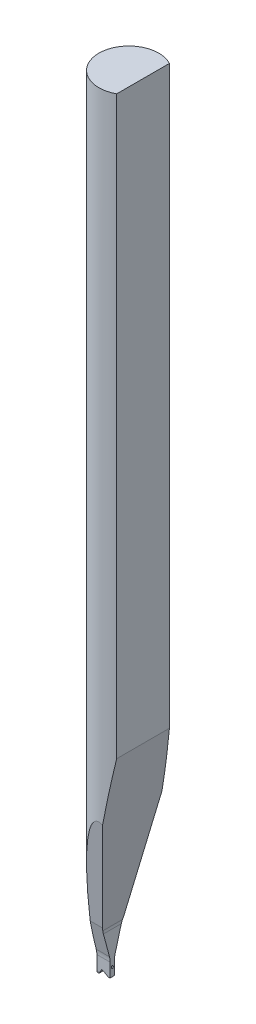
from build123d import *

# Parameters (mm, degrees)
TD_REV_FEATURE_DEPTH            = 21.0312
ISA_REV_FEATURE_DEPTH           = 22.061040395
ISA_REV_FEATURE_DEPTH_BACK      = 22.061040395
BA_REV_FEATURE_DEPTH            = 22.061040395
BA_REV_FEATURE_DEPTH_BACK       = 22.061040395
SLB_REV_FEATURE_DEPTH           = 22.061040395
SLB_REV_FEATURE_DEPTH_BACK      = 22.061040395
VR_REV_FEATURE_DEPTH            = 22.061040395
VR_REV_FEATURE_DEPTH_BACK       = 22.061040395
ND_REV_FEATURE_DEPTH            = 22.061040503
ND_REV_FEATURE_DEPTH_BACK       = 22.061040503
REV_HOLE_CUT_FEATURE_DEPTH      = 22.162851782
REV_HOLE_CUT_FEATURE_DEPTH_BACK = 22.162851782
REV_F_FR_FEATURE_R              = 0.0254
REV_F_BR_FEAUTRE_R              = 0.0254


with BuildPart() as part:
    # td_rev_sketch → td_rev_feature (new body)
    with BuildSketch(Plane(origin=(0, 0, 0), x_dir=(1, 0, 0), z_dir=(0, 1, 0))):
        with BuildLine():
            Line((0.37592, -0.697645113), (0.37592, 0.697645113))
            ThreePointArc((0.37592, 0.697645113), (-0.79248, 0), (0.37592, -0.697645113))
        make_face()
    extrude(amount=TD_REV_FEATURE_DEPTH)

    # isa_rev_sketch → isa_rev_feature (cut, two sides: drawn at the far end of the back side and taken through both)
    with BuildSketch(Plane(origin=(0, 0, 0), x_dir=(0, 0, -1), z_dir=(1, 0, 0)).offset(-ISA_REV_FEATURE_DEPTH_BACK)):
        Polygon((8.398066277, 47.339699483), (0.79248, 4.2062763), (0.0508, 0), (-0.0508, 0), (-0.79248, 4.2062763), (-8.398066277, 47.339699483), (-8.398066277, -40.25795204), (8.398066277, -40.25795204), align=None)
    extrude(amount=ISA_REV_FEATURE_DEPTH + ISA_REV_FEATURE_DEPTH_BACK, mode=Mode.SUBTRACT)

    # ba_rev_sketch → ba_rev_feature (cut, two sides: drawn at the far end of the back side and taken through both)
    with BuildSketch(Plane.XY.offset(-BA_REV_FEATURE_DEPTH_BACK)):
        Polygon((-52.01559187, -9.04993148), (-0.69088, 0), (-0.428729423, 0.04622422), (0.37592, 4.609617863), (9.42585148, 55.934329733), (85.165346017, -15.675992153), (23.723902667, -80.660253365), align=None)
    extrude(amount=BA_REV_FEATURE_DEPTH + BA_REV_FEATURE_DEPTH_BACK, mode=Mode.SUBTRACT)

    # slb_rev_sketch → slb_rev_feature (cut, two sides: drawn at the far end of the back side and taken through both)
    with BuildSketch(Plane.XY.offset(-SLB_REV_FEATURE_DEPTH_BACK)):
        with BuildLine():
            Line((-0.43688, -52.09380084), (-0.43688, 0))
            Line((-0.43688, 0), (-0.43688, 1.143))
            ThreePointArc((-0.43688, 1.143), (-0.434946907, 1.187275117), (-0.429162339, 1.231213274))
            Line((-0.429162339, 1.231213274), (0.37592, 5.797062104))
            Line((0.37592, 5.797062104), (9.421913584, 57.099441055))
            Line((9.421913584, 57.099441055), (113.187433376, 47.730703366))
            Line((113.187433376, 47.730703366), (103.328639792, -61.462538529))
            Line((103.328639792, -61.462538529), (-0.43688, -52.09380084))
        make_face()
    extrude(amount=SLB_REV_FEATURE_DEPTH + SLB_REV_FEATURE_DEPTH_BACK, mode=Mode.SUBTRACT)

    # vr_rev_sketch → vr_rev_feature (cut, two sides: drawn at the far end of the back side and taken through both)
    with BuildSketch(Plane(origin=(0, 0, 0), x_dir=(0, 0, -1), z_dir=(1, 0, 0)).offset(-VR_REV_FEATURE_DEPTH_BACK)):
        with BuildLine():
            Line((12.638111697, 47.42606773), (0.79248, 3.217568389))
            Line((0.79248, 3.217568389), (0.07445968, 0.537880075))
            ThreePointArc((0.07445968, 0.537880075), (0.06149601, 0.472707306), (0.05715, 0.4064))
            Line((0.05715, 0.4064), (0.05715, 0))
            Line((0.05715, 0), (-0.05715, 0))
            Line((-0.05715, 0), (-0.05715, 0.4064))
            ThreePointArc((-0.05715, 0.4064), (-0.06149601, 0.472707306), (-0.07445968, 0.537880075))
            Line((-0.07445968, 0.537880075), (-0.79248, 3.217568389))
            Line((-0.79248, 3.217568389), (-12.638111697, 47.42606773))
            Line((-12.638111697, 47.42606773), (-12.638111697, -44.109944949))
            Line((-12.638111697, -44.109944949), (12.638111697, -44.109944949))
            Line((12.638111697, -44.109944949), (12.638111697, 47.42606773))
        make_face()
    extrude(amount=VR_REV_FEATURE_DEPTH + VR_REV_FEATURE_DEPTH_BACK, mode=Mode.SUBTRACT)

    # erw_rev_sketch → nd_rev_feature (cut, two sides: drawn at the far end of the back side and taken through both)
    with BuildSketch(Plane.XY.offset(-ND_REV_FEATURE_DEPTH_BACK)):
        with BuildLine():
            Line((-0.73406, 0), (-0.668068864, 0.1143))
            ThreePointArc((-0.668068864, 0.1143), (-0.652645823, 0.126134516), (-0.633371819, 0.123597045))
            Line((-0.633371819, 0.123597045), (-0.476954112, 0.03328924))
            Line((-0.476954112, 0.03328924), (-0.419295457, 0))
            Line((-0.419295457, 0), (-0.73406, 0))
        make_face()
    extrude(amount=ND_REV_FEATURE_DEPTH + ND_REV_FEATURE_DEPTH_BACK, mode=Mode.SUBTRACT)


with BuildPart() as body_2:
    # rev_hole_sketch → rev_hole_feature (revolve)
    with BuildSketch(Plane.XY):
        Polygon((-0.703570884, -0.035921024), (-0.721531396, -0.017960512), (1.354405484, 2.057976368), (2.104599043, 1.307782809), (-0.395400957, 0.272248903), align=None)
    revolve(axis=Axis((-0.721531396, -0.017960512, 0), (0.7071067811865462, 0.7071067811865489, 0)))

    # rev_hole_cut_sketch → rev_hole_cut_feature (cut, two sides: drawn at the far end of the back side and taken through both)
    with BuildSketch(Plane.XY.offset(-REV_HOLE_CUT_FEATURE_DEPTH_BACK)):
        Polygon((-46.14120993, 26.397559629), (-0.79248, 0.215458196), (-0.419295457, 0), (44.929434473, -26.182101432), (-7.434768392, -116.879561292), (-98.505412795, -64.299900231), align=None)
    extrude(amount=REV_HOLE_CUT_FEATURE_DEPTH + REV_HOLE_CUT_FEATURE_DEPTH_BACK, mode=Mode.SUBTRACT)


with BuildPart() as part_1:
    add(part.part)

    # rev_hole_combine: cut body 2
    add(body_2.part, mode=Mode.SUBTRACT)

    # rev_f_fr_feature
    rev_f_fr_feature_edges = [part_1.edges().sort_by_distance(p)[0] for p in [
        (-0.79248, 0, 0),
    ]]
    fillet(rev_f_fr_feature_edges, radius=REV_F_FR_FEATURE_R)

    # rev_f_br_feautre
    rev_f_br_feautre_edges = [part_1.edges().sort_by_distance(p)[0] for p in [
        (-0.73406, 0, 0),
    ]]
    fillet(rev_f_br_feautre_edges, radius=REV_F_BR_FEAUTRE_R)


solid = part_1.part
